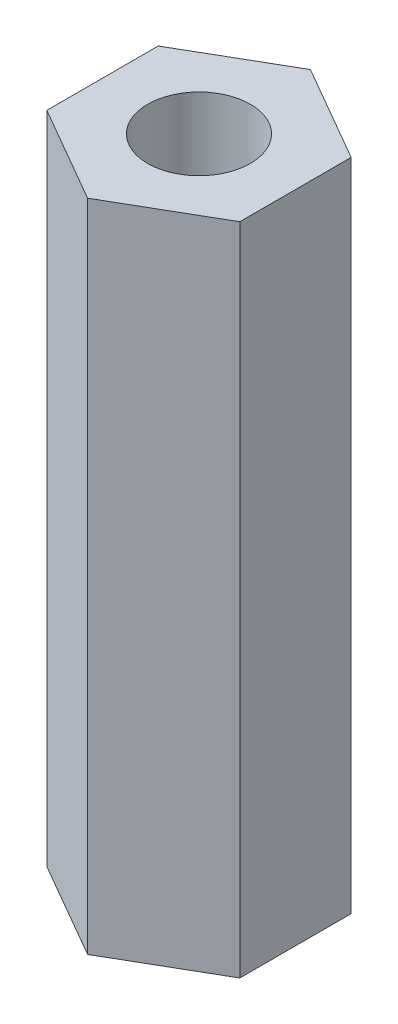
from build123d import *

# Parameters (mm, degrees)
SKETCH1_R           = 1.45
BOSS_EXTRUDE1_DEPTH = 18.5


with BuildPart() as part:
    # Sketch1 → Boss-Extrude1 (new body)
    with BuildSketch(Plane(origin=(0, 0, 0), x_dir=(1, 0, 0), z_dir=(0, 1, 0))):
        Polygon((0, 3.146558967), (-2.725, 1.573279484), (-2.725, -1.573279484), (0, -3.146558967), (2.725, -1.573279484), (2.725, 1.573279484), align=None)
        with Locations(Location((0, 0, 0), (0, 0, 270))):
            Circle(SKETCH1_R, mode=Mode.SUBTRACT)
    extrude(amount=BOSS_EXTRUDE1_DEPTH)


solid = part.part
